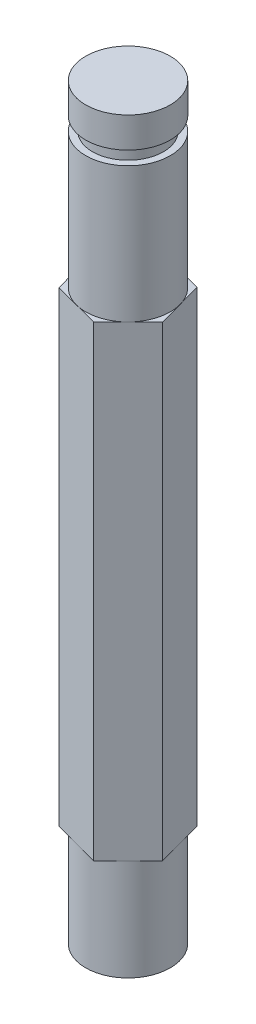
from build123d import *

# Parameters (mm, degrees)
BOSS_EXTRUDE1_DEPTH = 35.052
SKETCH3_R           = 3.175
BOSS_EXTRUDE2_DEPTH = 10.16
SKETCH4_R           = 2.667
BOSS_EXTRUDE3_DEPTH = 1.016
SKETCH5_R           = 3.175
BOSS_EXTRUDE4_DEPTH = 2.286
BOSS_EXTRUDE5_START = 7.62
SKETCH6_R           = 3.175
BOSS_EXTRUDE5_DEPTH = 7.62


with BuildPart() as part:
    # Sketch1 → Boss-Extrude1 (new body)
    with BuildSketch(Plane(origin=(0, 0, 0), x_dir=(1, 0, 0), z_dir=(0, 1, 0))):
        Polygon((2.586343195, 2.598396085), (-0.957105421, 3.539036952), (-3.543448616, 0.940640867), (-2.586343195, -2.598396085), (0.957105421, -3.539036952), (3.543448616, -0.940640867), align=None)
    extrude(amount=BOSS_EXTRUDE1_DEPTH)

    # Sketch3 → Boss-Extrude2 (add)
    with BuildSketch(Plane(origin=(0, 35.052, 0), x_dir=(1, 0, 0), z_dir=(0, 1, 0))):
        with Locations(Location((0, 0, 0), (0, 0, 75.133194449))):
            Circle(SKETCH3_R)
    extrude(amount=BOSS_EXTRUDE2_DEPTH)

    # Sketch4 → Boss-Extrude3 (add)
    with BuildSketch(Plane(origin=(0, 45.212, 0), x_dir=(1, 0, 0), z_dir=(0, 1, 0))):
        with Locations(Location((0, 0, 0), (0, 0, 270))):
            Circle(SKETCH4_R)
    extrude(amount=BOSS_EXTRUDE3_DEPTH)

    # Sketch5 → Boss-Extrude4 (add)
    with BuildSketch(Plane(origin=(0, 46.228, 0), x_dir=(1, 0, 0), z_dir=(0, 1, 0))):
        with Locations(Location((0, 0, 0), (0, 0, 75.133194449))):
            Circle(SKETCH5_R)
    extrude(amount=BOSS_EXTRUDE4_DEPTH)

    # Sketch6 → Boss-Extrude5 (add)
    with BuildSketch(Plane.XZ.offset(BOSS_EXTRUDE5_START)):
        with Locations(Location((0, 0, 0), (0, 0, 284.866805551))):
            Circle(SKETCH6_R)
    extrude(amount=-BOSS_EXTRUDE5_DEPTH)


solid = part.part
